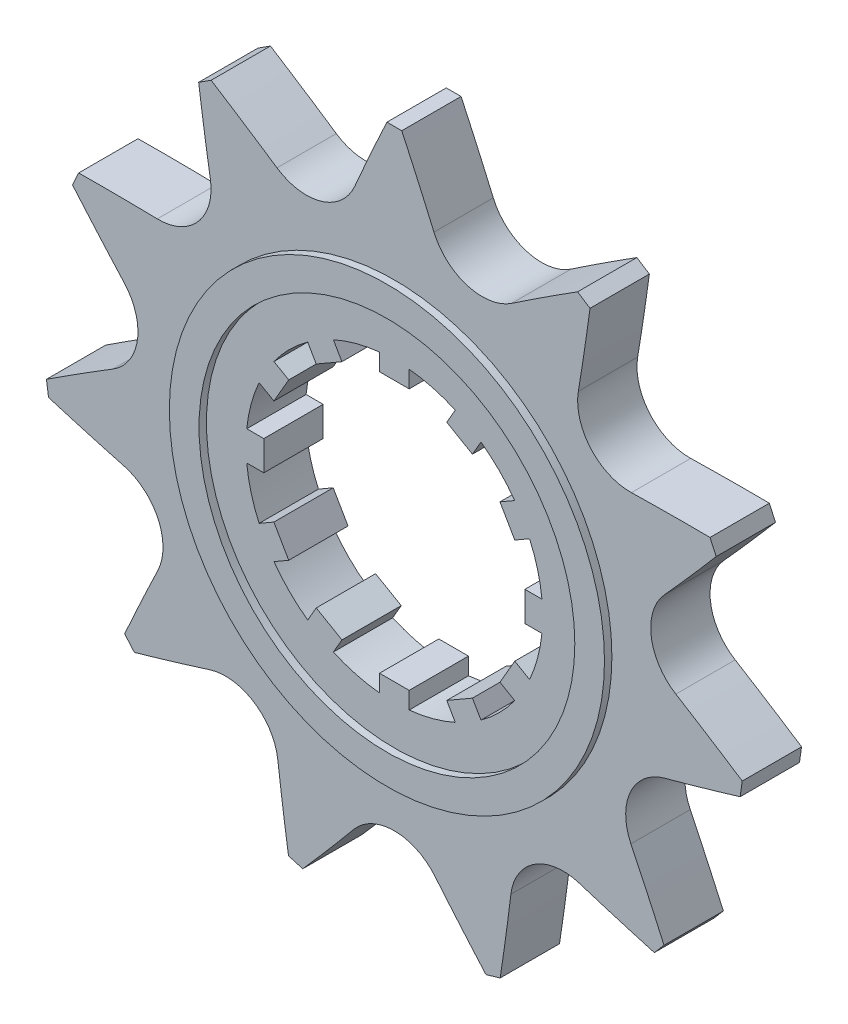
from build123d import *

# Parameters (mm, degrees)
BOSS_EXTRUDE1_DEPTH      = 2
CIRPATTERN1_COUNT        = 11
BOSS_EXTRUDE2_DEPTH      = 2
BOSS_EXTRUDE2_DEPTH_BACK = 2
SKETCH4_R                = 17.5
SKETCH6_R                = 14.669
SKETCH6_R_2              = 12.669
BOSS_EXTRUDE4_DEPTH      = 0.5
SKETCH7_R                = 10
CUT_EXTRUDE1_DEPTH       = 4
SKETCH8_W                = 2
SKETCH8_H                = 1.2
BOSS_EXTRUDE5_DEPTH      = 4
CIRPATTERN2_COUNT        = 12


with BuildPart() as part:
    # Sketch2 → Boss-Extrude1 (new, symmetric)
    with BuildSketch(Plane.XY):
        with BuildLine():
            Line((-0.5, 23.626113967), (0.5, 23.626113967))
            ThreePointArc((0.5, 23.626113967), (1.603484659, 21.216683922), (2.671054487, 18.791127038))
            ThreePointArc((2.671054487, 18.791127038), (3.577591086, 17.539110484), (4.930319745, 16.791127038))
            ThreePointArc((4.930319745, 16.791127038), (0, 17.5), (-4.930319745, 16.791127038))
            ThreePointArc((-4.930319745, 16.791127038), (-3.577591086, 17.539110484), (-2.671054487, 18.791127038))
            ThreePointArc((-2.671054487, 18.791127038), (-1.603484659, 21.216683922), (-0.5, 23.626113967))
        make_face()
    extrude(amount=BOSS_EXTRUDE1_DEPTH, both=True)


with BuildPart() as cirpattern1_1:
    # CirPattern1: pattern copy
    add(part.part.rotate(Axis((0, 0, 0), (0, 0, 1)), 1 * 360 / CIRPATTERN1_COUNT))


with BuildPart() as cirpattern1_2:
    # CirPattern1: pattern copy
    add(part.part.rotate(Axis((0, 0, 0), (0, 0, 1)), 2 * 360 / CIRPATTERN1_COUNT))


with BuildPart() as cirpattern1_3:
    # CirPattern1: pattern copy
    add(part.part.rotate(Axis((0, 0, 0), (0, 0, 1)), 3 * 360 / CIRPATTERN1_COUNT))


with BuildPart() as cirpattern1_4:
    # CirPattern1: pattern copy
    add(part.part.rotate(Axis((0, 0, 0), (0, 0, 1)), 4 * 360 / CIRPATTERN1_COUNT))


with BuildPart() as cirpattern1_5:
    # CirPattern1: pattern copy
    add(part.part.rotate(Axis((0, 0, 0), (0, 0, 1)), 5 * 360 / CIRPATTERN1_COUNT))


with BuildPart() as cirpattern1_6:
    # CirPattern1: pattern copy
    add(part.part.rotate(Axis((0, 0, 0), (0, 0, 1)), 6 * 360 / CIRPATTERN1_COUNT))


with BuildPart() as cirpattern1_7:
    # CirPattern1: pattern copy
    add(part.part.rotate(Axis((0, 0, 0), (0, 0, 1)), 7 * 360 / CIRPATTERN1_COUNT))


with BuildPart() as cirpattern1_8:
    # CirPattern1: pattern copy
    add(part.part.rotate(Axis((0, 0, 0), (0, 0, 1)), 8 * 360 / CIRPATTERN1_COUNT))


with BuildPart() as cirpattern1_9:
    # CirPattern1: pattern copy
    add(part.part.rotate(Axis((0, 0, 0), (0, 0, 1)), 9 * 360 / CIRPATTERN1_COUNT))


with BuildPart() as cirpattern1_10:
    # CirPattern1: pattern copy
    add(part.part.rotate(Axis((0, 0, 0), (0, 0, 1)), 10 * 360 / CIRPATTERN1_COUNT))


with BuildPart() as part_1:
    add(part.part)

    add(cirpattern1_1.part)  # Boss-Extrude2 merges CirPattern1_1

    add(cirpattern1_2.part)  # Boss-Extrude2 merges CirPattern1_2

    add(cirpattern1_3.part)  # Boss-Extrude2 merges CirPattern1_3

    add(cirpattern1_4.part)  # Boss-Extrude2 merges CirPattern1_4

    add(cirpattern1_5.part)  # Boss-Extrude2 merges CirPattern1_5

    add(cirpattern1_6.part)  # Boss-Extrude2 merges CirPattern1_6

    add(cirpattern1_7.part)  # Boss-Extrude2 merges CirPattern1_7

    add(cirpattern1_8.part)  # Boss-Extrude2 merges CirPattern1_8

    add(cirpattern1_9.part)  # Boss-Extrude2 merges CirPattern1_9

    add(cirpattern1_10.part)  # Boss-Extrude2 merges CirPattern1_10
    # Sketch4 → Boss-Extrude2 (add, two sides: drawn at the far end of the back side and taken through both)
    with BuildSketch(Plane.XY.offset(-BOSS_EXTRUDE2_DEPTH_BACK)):
        Circle(SKETCH4_R)
    extrude(amount=BOSS_EXTRUDE2_DEPTH + BOSS_EXTRUDE2_DEPTH_BACK)

    # Sketch6 → Boss-Extrude4 (add)
    with BuildSketch(Plane.XY.offset(2)):
        with Locations(Location((0, 0, 0), (0, 0, 180))):
            Circle(SKETCH6_R)
        Circle(SKETCH6_R_2, mode=Mode.SUBTRACT)
    extrude(amount=BOSS_EXTRUDE4_DEPTH)

    # Sketch7 → Cut-Extrude1 (cut)
    with BuildSketch(Plane.XY.offset(2)):
        Circle(SKETCH7_R)
    extrude(amount=-CUT_EXTRUDE1_DEPTH, mode=Mode.SUBTRACT)

    # Sketch8 → Boss-Extrude5 (add)
    with BuildSketch(Plane.XY.offset(2)):
        with Locations((0, 9.4)):
            Rectangle(SKETCH8_W, SKETCH8_H)
    boss_extrude5 = extrude(amount=-BOSS_EXTRUDE5_DEPTH)

    # CirPattern2: Boss-Extrude5 ×12 about axis
    cirpattern2_axis = Axis((0, 0, 0), (0, 0, 1))
    for i in range(1, CIRPATTERN2_COUNT):
        add(boss_extrude5.rotate(cirpattern2_axis, i * 360 / CIRPATTERN2_COUNT))


solid = part_1.part
